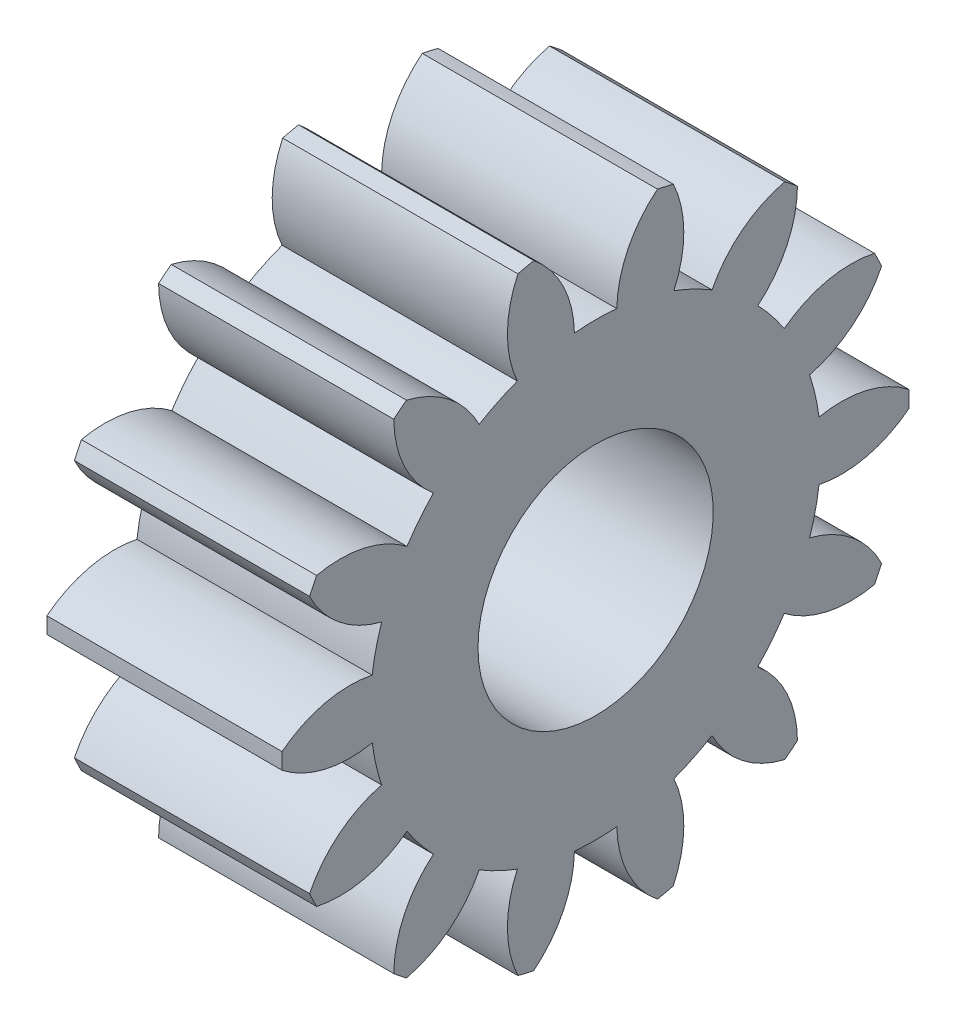
from build123d import *

# Parameters (mm, degrees)
BASPROSKE_W     = 3
BASPROSKE_H     = 4
TOOTHCUT_DEPTH  = 7.403124237
TEETHCUTS_COUNT = 14
TEETHCUTS_ANGLE = 334.285714286
BORSKE_R        = 1.5
BORE_DEPTH      = 50.0000508


with BuildPart() as part:
    # BasProSke → Base-Revolve (revolve)
    with BuildSketch(Plane(origin=(0, 0, 0), x_dir=(1, 0, 0), z_dir=(0, 1, 0)), mode=Mode.PRIVATE) as base_revolve_sk:
        with Locations((1.5, 2)):
            Rectangle(BASPROSKE_W, BASPROSKE_H)
    revolve(base_revolve_sk.sketch.rotate(Axis((-10, 0, 0), (1, 0, 0)), 180), axis=Axis((-10, 0, 0), (1, 0, 0)))

    # TooCutSke → ToothCut (cut, through all)
    with BuildSketch(Plane(origin=(0, 0, 0), x_dir=(0, 0, -1), z_dir=(1, 0, 0))):
        with BuildLine():
            ThreePointArc((0.270186573, 2.861271608), (0, 2.874), (-0.270186573, 2.861271608))
            ThreePointArc((-0.270186573, 2.861271608), (-0.419730174, 3.4635664), (-0.814922833, 3.942048444))
            ThreePointArc((-0.814922833, 3.942048444), (0, 4.0254), (0.814922833, 3.942048444))
            ThreePointArc((0.814922833, 3.942048444), (0.419730174, 3.4635664), (0.270186573, 2.861271608))
        make_face()
    toothcut = extrude(amount=TOOTHCUT_DEPTH, mode=Mode.SUBTRACT)

    # TeethCuts: ToothCut ×14 about axis
    teethcuts_axis = Axis((-10, 0, 0), (1, 0, 0))
    for i in range(1, TEETHCUTS_COUNT):
        add(toothcut.rotate(teethcuts_axis, i * TEETHCUTS_ANGLE / (TEETHCUTS_COUNT - 1)), mode=Mode.SUBTRACT)

    # BorSke → Bore (cut, symmetric)
    with BuildSketch(Plane(origin=(0, 0, 0), x_dir=(0, 0, -1), z_dir=(1, 0, 0))):
        with Locations(Location((0, 0, 0), (0, 0, 180))):
            Circle(BORSKE_R)
    extrude(amount=BORE_DEPTH, both=True, mode=Mode.SUBTRACT)


solid = part.part
